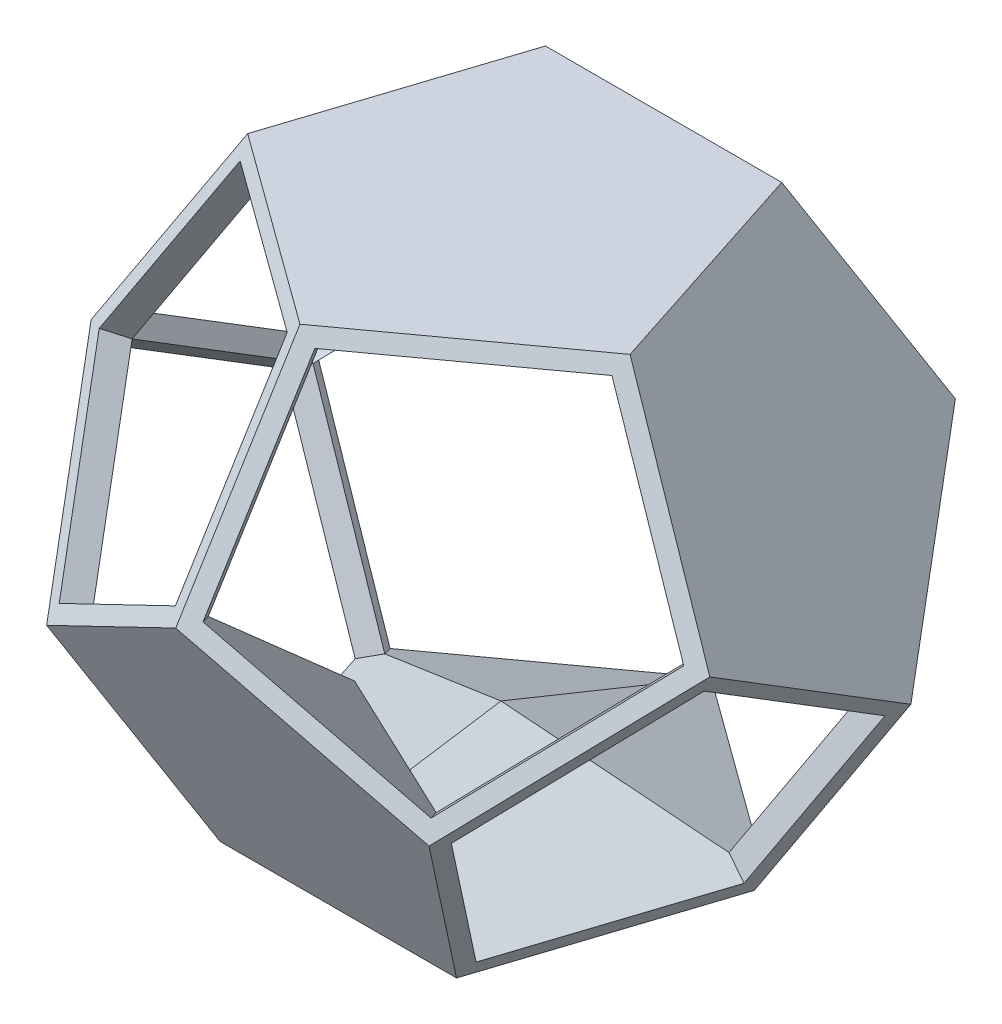
from build123d import *

# Parameters (mm, degrees)
CREATION_EXTRUDE_DEPTH = 130.901699304
CREATION_EXTRUDE_TAPER = -26.56505118
SKETCH2_OUTSIDE_W      = 455.432
SKETCH2_OUTSIDE_H      = 443.246
CREATION_CUT_DEPTH     = 130.901699304
CREATION_CUT_TAPER     = 26.56505118
CUT_EXTRUDE_B_DEPTH    = 50.8
C_INV_DEPTH            = 50.8
CUT_EXTRUDE_D_DEPTH    = 50.8
D_INV_DEPTH            = 50.8
CUT_EXTRUDE_E_DEPTH    = 50.8
E_INV_DEPTH            = 50.8
CUT_EXTRUDE_F_DEPTH    = 50.8
F_INV_DEPTH            = 50.8


with BuildPart() as part:
    # Sketch1 → creation_extrude (new body)
    with BuildSketch(Plane(origin=(0, 0, 0), x_dir=(1, 0, 0), z_dir=(0, 1, 0))):
        Polygon((0, 49.999999949), (-47.552825766, 15.450849703), (-29.389262585, -40.450849677), (29.389262585, -40.450849677), (47.552825766, 15.450849703), align=None)
    extrude(amount=CREATION_EXTRUDE_DEPTH, taper=CREATION_EXTRUDE_TAPER)

    # Sketch2 outside → creation_cut (cut)
    with BuildSketch(Plane(origin=(0, 130.901699304, 0), x_dir=(1, 0, 0), z_dir=(0, 1, 0))):
        with Locations((0, 12.5)):
            Rectangle(SKETCH2_OUTSIDE_W, SKETCH2_OUTSIDE_H)
        Polygon((0, -49.999999949), (47.552825766, -15.450849703), (29.389262585, 40.450849677), (-29.389262585, 40.450849677), (-47.552825766, -15.450849703), align=None, mode=Mode.SUBTRACT)
    extrude(amount=-CREATION_CUT_DEPTH, taper=CREATION_CUT_TAPER, mode=Mode.SUBTRACT)

    # Sketch5 → Cut-Extrude B (cut)
    with BuildSketch(Plane(origin=(0, 42.360679738, -84.721359466), x_dir=(-1, 0, 0), z_dir=(-9.08060963965006e-15, 0.4472135955455734, -0.8944271909771081))):
        Polygon((-42.797543189, 44.635254864), (1e-09, 13.541019643), (42.79754319, 44.635254866), (26.450336325, 94.946784308), (-26.450336327, 94.946784307), align=None)
    extrude(amount=-CUT_EXTRUDE_B_DEPTH, mode=Mode.SUBTRACT)

    # Sketch8 → C_inv (cut)
    with BuildSketch(Plane(origin=(-30.776835339, -16.180339872, 9.999999989), x_dir=(0.2446443083020028, 0.12861712429362696, 0.9610446387935747), z_dir=(-0.8506508083303469, -0.4472135955455736, 0.27639320224297786))):
        Polygon((-31.935023341, 77.848060657), (-22.992425992, 25.708717357), (29.358450763, 18.101689683), (52.77047459, 65.539631327), (14.889024305, 102.464919293), align=None)
    extrude(amount=-C_INV_DEPTH, mode=Mode.SUBTRACT)

    # Sketch9 → Cut-Extrude D (cut)
    with BuildSketch(Plane(origin=(49.797965648, 42.360679738, 68.541019594), x_dir=(0.8506508083603209, -0.27639320226847824, -0.44721359547279954), z_dir=(0.5257311121057348, 0.44721359554557366, 0.7236067977315217))):
        Polygon((-4.184405192, 98.473361345), (-54.495934634, 82.126154482), (-54.495934634, 29.22548183), (-4.184405192, 12.878274966), (26.90983003, 55.675818156), align=None)
    extrude(amount=-CUT_EXTRUDE_D_DEPTH, mode=Mode.SUBTRACT)

    # Sketch10 → D_inv (cut)
    with BuildSketch(Plane(origin=(-19.021130306, -16.180339872, -26.180339859), x_dir=(-0.8506508083603233, 0.27639320226847536, 0.44721359547279665), z_dir=(-0.5257311121057309, -0.44721359554557344, -0.7236067977315247))):
        Polygon((31.995934659, 98.473361351), (-18.315594783, 82.126154488), (-18.315594783, 29.225481836), (31.995934659, 12.878274972), (63.090169881, 55.675818162), align=None)
    extrude(amount=-D_INV_DEPTH, mode=Mode.SUBTRACT)

    # Sketch11 → Cut-Extrude E (cut)
    with BuildSketch(Plane(origin=(-49.797965648, 42.360679738, 68.541019594), x_dir=(0.8506508083603298, 0.2763932022684677, 0.447213595472789), z_dir=(-0.5257311121057203, 0.44721359554557355, 0.7236067977315324))):
        Polygon((4.184405192, 98.473361345), (-26.90983003, 55.675818156), (4.184405192, 12.878274966), (54.495934634, 29.22548183), (54.495934634, 82.126154482), align=None)
    extrude(amount=-CUT_EXTRUDE_E_DEPTH, mode=Mode.SUBTRACT)

    # Sketch12 → E_inv (cut)
    with BuildSketch(Plane(origin=(19.021130306, -16.180339872, -26.180339859), x_dir=(-0.8506508083603274, -0.27639320226847064, -0.44721359547279194), z_dir=(0.5257311121057243, -0.44721359554557355, -0.7236067977315294))):
        Polygon((-31.99593466, 98.473361351), (-63.090169881, 55.67581816), (-31.995934658, 12.878274972), (18.315594784, 29.225481837), (18.315594782, 82.126154489), align=None)
    extrude(amount=-E_INV_DEPTH, mode=Mode.SUBTRACT)

    # Sketch13 → Cut-Extrude F (cut)
    with BuildSketch(Plane(origin=(-80.574800989, 42.360679738, -26.180339862), x_dir=(-0.24464430830199108, 0.12861712429362016, 0.9610446387935785), z_dir=(-0.8506508083303513, 0.4472135955455735, -0.2763932022429644))):
        Polygon((-12.522250637, 97.763517637), (-35.934274461, 50.325575991), (1.947175826, 13.400288027), (48.771223471, 38.017146666), (39.828626119, 90.156489966), align=None)
    extrude(amount=-CUT_EXTRUDE_F_DEPTH, mode=Mode.SUBTRACT)

    # Sketch14 → F_inv (cut)
    with BuildSketch(Plane(origin=(30.776835339, -16.180339872, 9.999999989), x_dir=(0.2446443083019939, -0.12861712429362177, -0.9610446387935776), z_dir=(0.8506508083303502, -0.4472135955455736, 0.2763932022429676))):
        Polygon((-29.358450768, 18.101689686), (22.992425988, 25.708717353), (31.935023344, 77.848060652), (-14.889024299, 102.464919294), (-52.770474589, 65.539631333), align=None)
    extrude(amount=-F_INV_DEPTH, mode=Mode.SUBTRACT)


with BuildPart() as body_2:
    # of the pieces the cut leaves, the one that is kept (f_inv_keep)
    add(part.part.solids().sort_by_distance((0, 0, -49.999999949))[0])


solid = body_2.part
